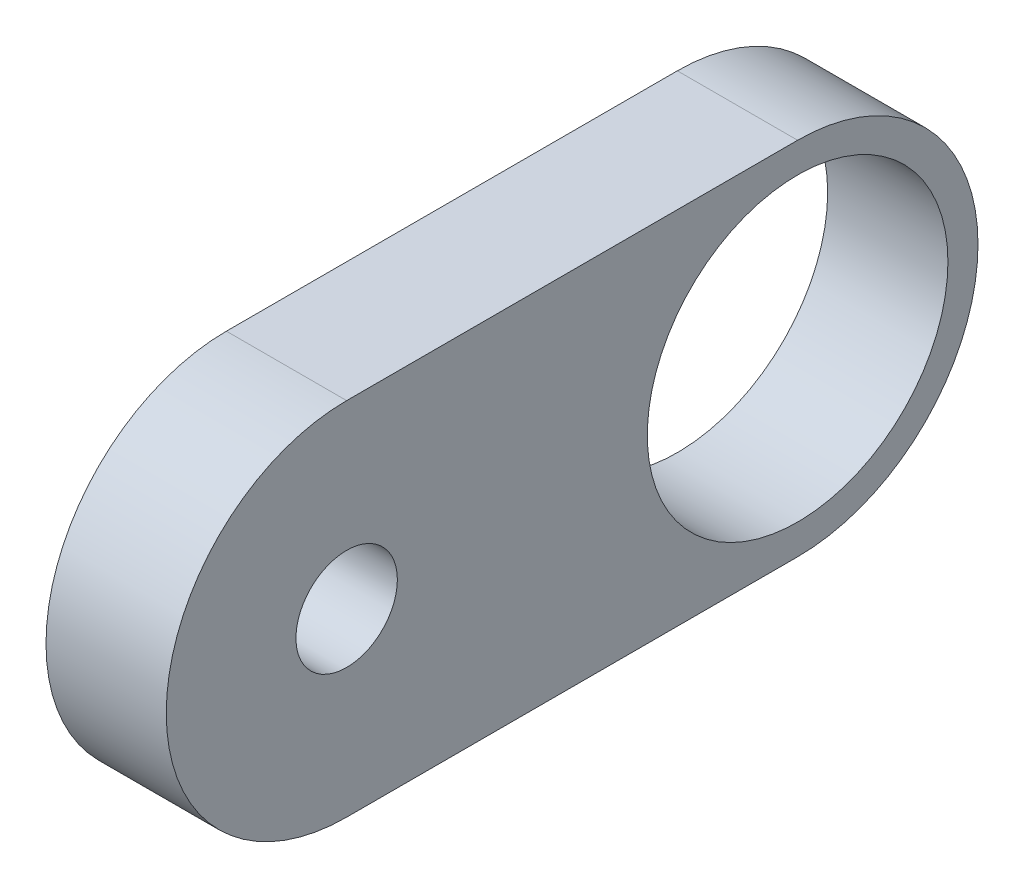
from build123d import *

# Parameters (mm, degrees)
SKETCH1_R           = 12.7
SKETCH1_R_2         = 4.28498
BOSS_EXTRUDE1_DEPTH = 10.159999949


with BuildPart() as part:
    # Sketch1 → Boss-Extrude1 (new body)
    with BuildSketch(Plane.YZ):
        with BuildLine():
            Line((-60.873619371, 15.361912765), (-60.873619371, -22.738087235))
            ThreePointArc((-60.873619371, -22.738087235), (-45.633619371, -37.978087235), (-30.393619371, -22.738087235))
            Line((-30.393619371, -22.738087235), (-30.393619371, 15.361912765))
            ThreePointArc((-30.393619371, 15.361912765), (-45.633619371, 30.601912765), (-60.873619371, 15.361912765))
        make_face()
        with Locations(Location((-45.633619371, -22.738087235, 0), (0, 0, 270))):
            Circle(SKETCH1_R, mode=Mode.SUBTRACT)
        with Locations(Location((-45.633619371, 15.361912765, 0), (0, 0, 270))):
            Circle(SKETCH1_R_2, mode=Mode.SUBTRACT)
    extrude(amount=BOSS_EXTRUDE1_DEPTH)


solid = part.part
